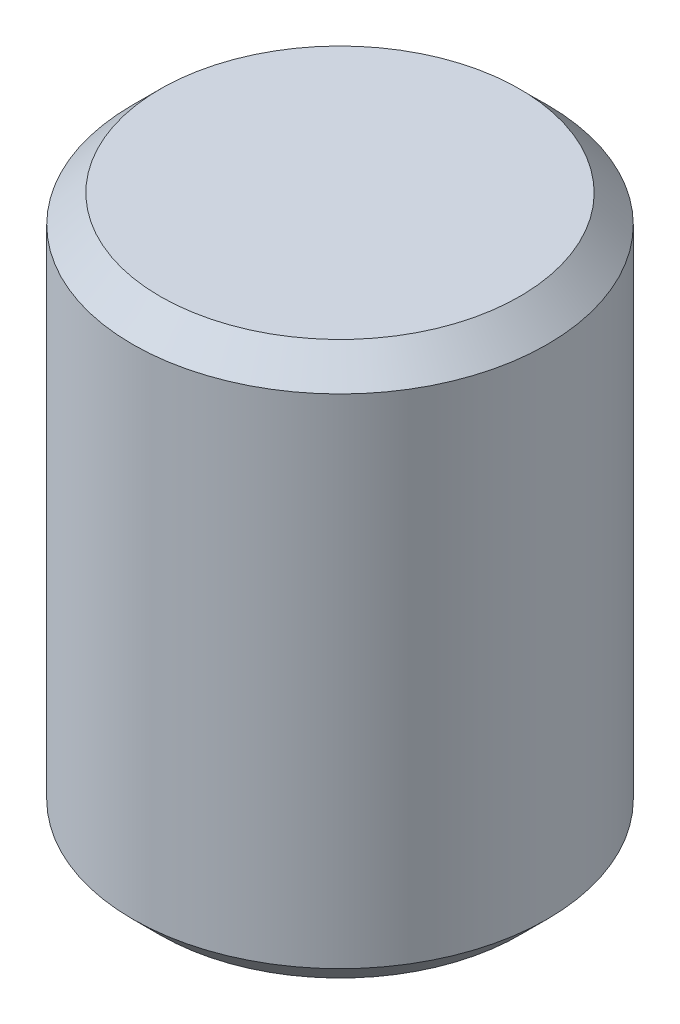
from build123d import *

# Parameters (mm, degrees)
SKETCH_1_R      = 15
EXTRUDE_1_DEPTH = 40
CHAMFER_1_SIZE  = 2


with BuildPart() as part:
    # Эскиз1 → Бобышка-Вытянуть1 (new body)
    with BuildSketch(Plane(origin=(0, 0, 0), x_dir=(1, 0, 0), z_dir=(0, 1, 0))):
        with Locations(Location((0, 0, 0), (0, 0, 270))):
            Circle(SKETCH_1_R)
    extrude(amount=EXTRUDE_1_DEPTH)

    # Фаска1
    chamfer_1_edges = [part.edges().sort_by_distance(p)[0] for p in [
        (0, 0, -15),
        (0, 40, -15),
    ]]
    chamfer(chamfer_1_edges, length=CHAMFER_1_SIZE)


solid = part.part
